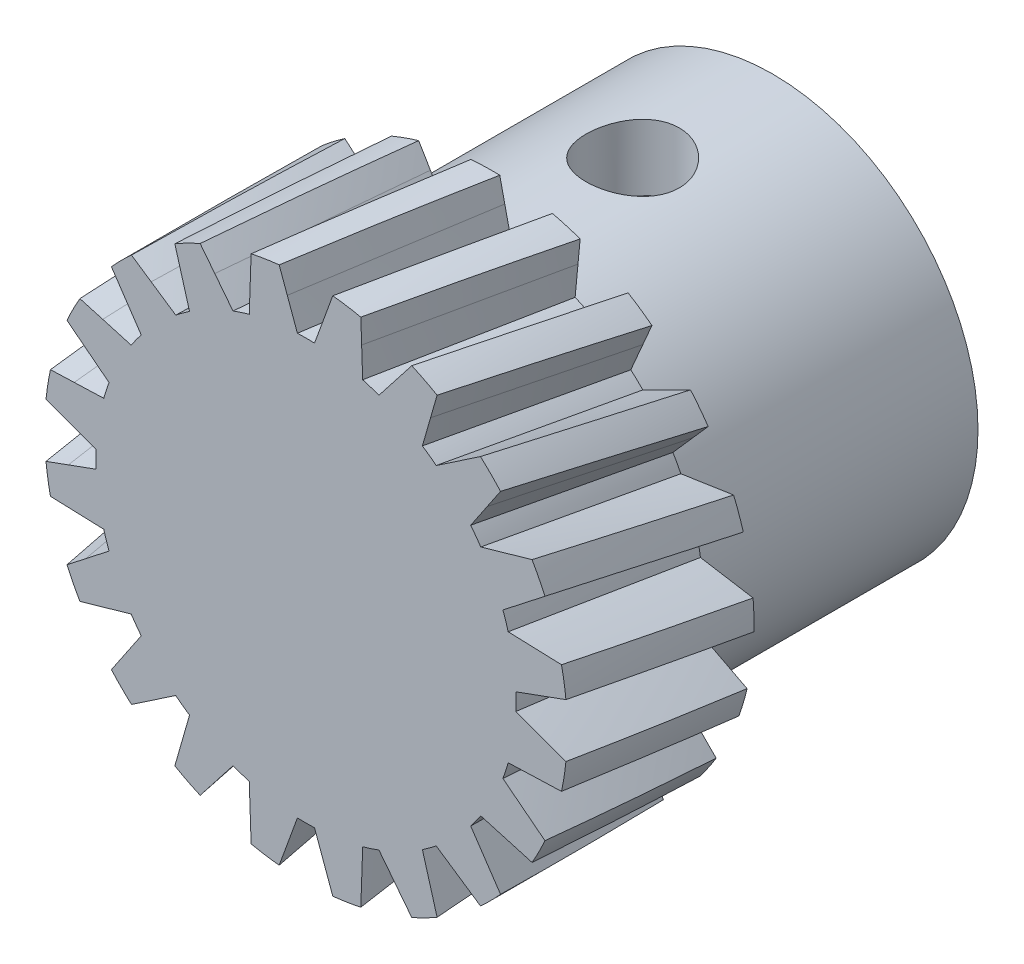
from build123d import *

# Parameters (mm, degrees)
SKETCH1_R               = 14
BOSS_EXTRUDE1_DEPTH     = 10
SKETCH6_R               = 11
SKETCH6_R_2             = 7.5
BOSS_EXTRUDE2_DEPTH     = 15
CIRPATTERN3_COUNT       = 20
CUT_EXTRUDE5_DEPTH      = 25
CUT_EXTRUDE5_DEPTH_BACK = 29
SKETCH10_R              = 2.5


with BuildPart() as part:
    # Sketch1 → Boss-Extrude1 (new body)
    with BuildSketch(Plane.XY):
        Circle(SKETCH1_R)
    extrude(amount=BOSS_EXTRUDE1_DEPTH)

    # Sketch6 → Boss-Extrude2 (add)
    with BuildSketch(Plane(origin=(0, 0, 0), x_dir=(-1, 0, 0), z_dir=(0, 0, -1))):
        with Locations(Location((0, 0, 0), (0, 0, 180))):
            Circle(SKETCH6_R)
        Circle(SKETCH6_R_2, mode=Mode.SUBTRACT)
    extrude(amount=BOSS_EXTRUDE2_DEPTH)

    # Sketch2 → Cut-Loft3 section 0
    with BuildSketch(Plane.XY.offset(10)):
        with BuildLine():
            Line((1, 12.73), (1.503224006, 14.112596593))
            ThreePointArc((1.503224006, 14.112596593), (0, 14.192429849), (-1.503224006, 14.112596593))
            Line((-1.503224006, 14.112596593), (-1, 12.73))
            Line((-1, 12.73), (-0.45793044, 11.240676123))
            ThreePointArc((-0.45793044, 11.240676123), (0, 11.25), (0.45793044, 11.240676123))
            Line((0.45793044, 11.240676123), (1, 12.73))
        make_face()
    # Sketch4 → Cut-Loft3 section 1
    with BuildSketch(Plane(origin=(0, 0, 0), x_dir=(-1, 0, 0), z_dir=(0, 0, -1))):
        with BuildLine():
            Line((-2.634102422, 12.534528489), (-3.287959312, 13.796485334))
            ThreePointArc((-3.287959312, 13.796485334), (-1.824235882, 14.065057677), (-0.340428382, 14.178779655))
            Line((-0.340428382, 14.178779655), (-0.650715169, 12.791773519))
            Line((-0.650715169, 12.791773519), (-1.005701453, 11.204957143))
            ThreePointArc((-1.005701453, 11.204957143), (-1.447003298, 11.156553296), (-1.886051787, 11.090775837))
            Line((-1.886051787, 11.090775837), (-2.634102422, 12.534528489))
        make_face()
    cut_loft3 = loft(mode=Mode.SUBTRACT)

    # CirPattern3: Cut-Loft3 ×20 about axis
    cirpattern3_axis = Axis((0, 0, 0), (0, 0, -1))
    for i in range(1, CIRPATTERN3_COUNT):
        add(cut_loft3.rotate(cirpattern3_axis, i * 360 / CIRPATTERN3_COUNT), mode=Mode.SUBTRACT)

    # Sketch10 → Cut-Extrude5 (cut, two sides: drawn at the far end of the back side and taken through both)
    with BuildSketch(Plane(origin=(0, 0, 0), x_dir=(1, 0, 0), z_dir=(0, 1, 0)).offset(-CUT_EXTRUDE5_DEPTH_BACK)):
        with Locations(Location((0, 7.5, 0), (0, 0, 270))):
            Circle(SKETCH10_R)
    extrude(amount=CUT_EXTRUDE5_DEPTH + CUT_EXTRUDE5_DEPTH_BACK, mode=Mode.SUBTRACT)


solid = part.part
